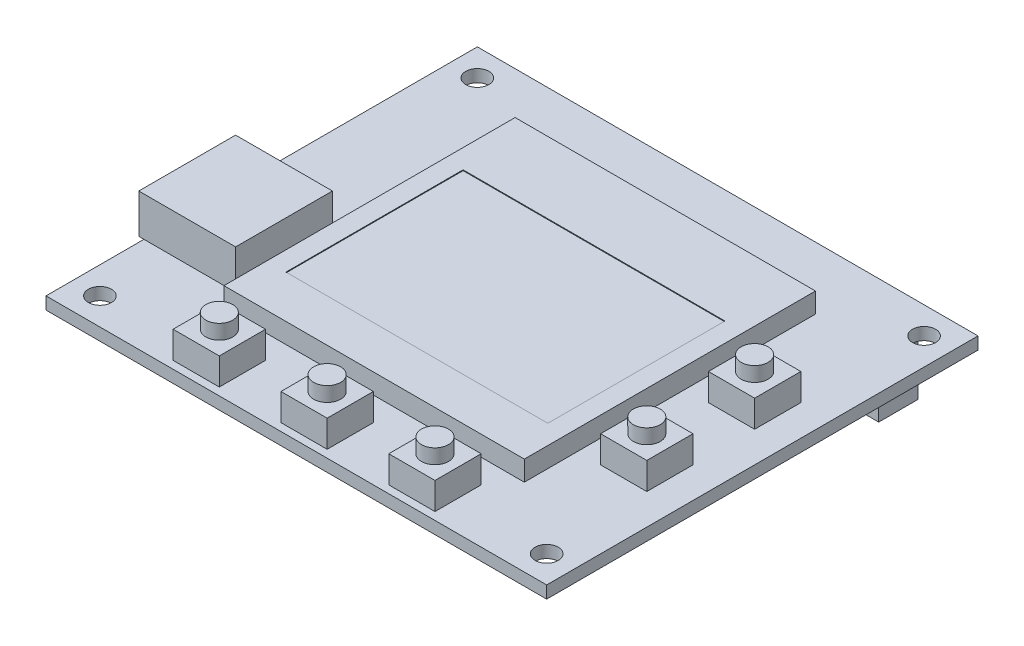
from build123d import *

# Parameters (mm, degrees)
SKETCH1_W             = 65
SKETCH1_H             = 56
SKETCH1_R             = 1.5
BOSS_EXTRUDE1_DEPTH   = 1.6
SKETCH2_W             = 39
SKETCH2_H             = 37.8
BOSS_EXTRUDE2_DEPTH   = 2.6
SKETCH3_W             = 34
SKETCH3_H             = 23
CUT_EXTRUDE1_DEPTH    = 0.1
SKETCH4_W             = 12.57
SKETCH4_H             = 12.57
BOSS_EXTRUDE3_DEPTH   = 5.1
SKETCH5_W             = 6
SKETCH5_H             = 6
BOSS_EXTRUDE4_DEPTH   = 3.5
BOSS_EXTRUDE4_2_DEPTH = 3.5
BOSS_EXTRUDE4_3_DEPTH = 3.5
BOSS_EXTRUDE4_4_DEPTH = 3.5
BOSS_EXTRUDE4_5_DEPTH = 3.5
SKETCH6_R             = 1.75
BOSS_EXTRUDE5_DEPTH   = 1.9
SKETCH7_W             = 51.3
SKETCH7_H             = 5.08
BOSS_EXTRUDE6_DEPTH   = 8.5


with BuildPart() as part:
    # Sketch1 → Boss-Extrude1 (new body)
    with BuildSketch(Plane(origin=(0, 0, 0), x_dir=(1, 0, 0), z_dir=(0, 1, 0))):
        Rectangle(SKETCH1_W, SKETCH1_H)
        with Locations(Location((-29, 24.5, 0), (0, 0, 270))):
            Circle(SKETCH1_R, mode=Mode.SUBTRACT)
        with Locations(Location((29, 24.5, 0), (0, 0, 270))):
            Circle(SKETCH1_R, mode=Mode.SUBTRACT)
        with Locations(Location((29, -24.5, 0), (0, 0, 270))):
            Circle(SKETCH1_R, mode=Mode.SUBTRACT)
        with Locations(Location((-29, -24.5, 0), (0, 0, 270))):
            Circle(SKETCH1_R, mode=Mode.SUBTRACT)
    extrude(amount=BOSS_EXTRUDE1_DEPTH)


with BuildPart() as body_2:
    # Sketch2 → Boss-Extrude2 (new body)
    with BuildSketch(Plane(origin=(0, 1.6, 0), x_dir=(1, 0, 0), z_dir=(0, 1, 0))):
        with Locations((0, 1)):
            Rectangle(SKETCH2_W, SKETCH2_H)
    extrude(amount=BOSS_EXTRUDE2_DEPTH)

    # Sketch3 → Cut-Extrude1 (cut)
    with BuildSketch(Plane(origin=(0, 4.2, 0), x_dir=(1, 0, 0), z_dir=(0, 1, 0))):
        with Locations((0, -0.85)):
            Rectangle(SKETCH3_W, SKETCH3_H)
    extrude(amount=-CUT_EXTRUDE1_DEPTH, mode=Mode.SUBTRACT)


with BuildPart() as body_3:
    # Sketch4 → Boss-Extrude3 (new body)
    with BuildSketch(Plane(origin=(0, 1.6, 0), x_dir=(1, 0, 0), z_dir=(0, 1, 0))):
        with Locations((-26.885, -9)):
            Rectangle(SKETCH4_W, SKETCH4_H)
    extrude(amount=BOSS_EXTRUDE3_DEPTH)


with BuildPart() as body_4:
    # Sketch5 → Boss-Extrude4 (new body)
    with BuildSketch(Plane(origin=(0, 1.6, 0), x_dir=(1, 0, 0), z_dir=(0, 1, 0))):
        with Locations((0, -24)):
            Rectangle(SKETCH5_W, SKETCH5_H)
    extrude(amount=BOSS_EXTRUDE4_DEPTH)



with BuildPart() as body_5:
    # Sketch5 → Boss-Extrude4 2 (new body)
    with BuildSketch(Plane(origin=(0, 1.6, 0), x_dir=(1, 0, 0), z_dir=(0, 1, 0))):
        with Locations((14, -24)):
            Rectangle(SKETCH5_W, SKETCH5_H)
    extrude(amount=BOSS_EXTRUDE4_2_DEPTH)


with BuildPart() as body_6:
    # Sketch5 → Boss-Extrude4 3 (new body)
    with BuildSketch(Plane(origin=(0, 1.6, 0), x_dir=(1, 0, 0), z_dir=(0, 1, 0))):
        with Locations((-14, -24)):
            Rectangle(SKETCH5_W, SKETCH5_H)
    extrude(amount=BOSS_EXTRUDE4_3_DEPTH)


with BuildPart() as body_7:
    # Sketch5 → Boss-Extrude4 4 (new body)
    with BuildSketch(Plane(origin=(0, 1.6, 0), x_dir=(1, 0, 0), z_dir=(0, 1, 0))):
        with Locations((25.5, 6)):
            Rectangle(SKETCH5_W, SKETCH5_H)
    extrude(amount=BOSS_EXTRUDE4_4_DEPTH)


with BuildPart() as body_8:
    # Sketch5 → Boss-Extrude4 5 (new body)
    with BuildSketch(Plane(origin=(0, 1.6, 0), x_dir=(1, 0, 0), z_dir=(0, 1, 0))):
        with Locations((25.5, -8)):
            Rectangle(SKETCH5_W, SKETCH5_H)
    extrude(amount=BOSS_EXTRUDE4_5_DEPTH)


with BuildPart() as body_4_1:
    add(body_4.part)

    add(body_5.part)  # Boss-Extrude5 merges body 5

    add(body_6.part)  # Boss-Extrude5 merges body 6

    add(body_7.part)  # Boss-Extrude5 merges body 7

    add(body_8.part)  # Boss-Extrude5 merges body 8
    # Sketch6 → Boss-Extrude5 (add)
    with BuildSketch(Plane(origin=(0, 5.1, 0), x_dir=(1, 0, 0), z_dir=(0, 1, 0))):
        with Locations(Location((-14, -24, 0), (0, 0, 90))):
            Circle(SKETCH6_R)
        with Locations(Location((0, -24, 0), (0, 0, 90))):
            Circle(SKETCH6_R)
        with Locations(Location((14, -24, 0), (0, 0, 90))):
            Circle(SKETCH6_R)
        with Locations(Location((25.5, -8, 0), (0, 0, 90))):
            Circle(SKETCH6_R)
        with Locations(Location((25.5, 6, 0), (0, 0, 90))):
            Circle(SKETCH6_R)
    extrude(amount=BOSS_EXTRUDE5_DEPTH)


with BuildPart() as body_5_2:
    # Sketch7 → Boss-Extrude6 (new body)
    with BuildSketch(Plane.XZ):
        with Locations((0, -24.5)):
            Rectangle(SKETCH7_W, SKETCH7_H)
    extrude(amount=BOSS_EXTRUDE6_DEPTH)


solid = Compound([part.part, body_2.part, body_3.part, body_4_1.part, body_5_2.part])
